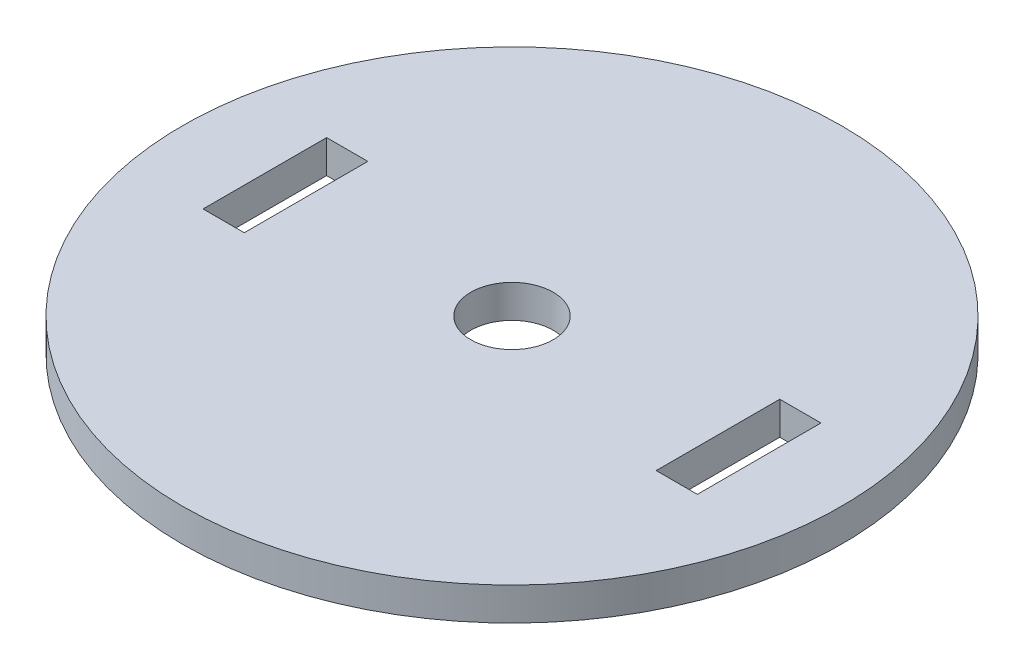
from build123d import *

# Parameters (mm, degrees)
SKETCH1_R           = 40
SKETCH1_R_2         = 5
BOSS_EXTRUDE1_DEPTH = 4
SKETCH2_W           = 5
SKETCH2_H           = 15
CUT_EXTRUDE1_DEPTH  = 4


with BuildPart() as part:
    # Sketch1 → Boss-Extrude1 (new body)
    with BuildSketch(Plane(origin=(0, 0, 0), x_dir=(1, 0, 0), z_dir=(0, 1, 0))):
        with Locations(Location((0, 0, 0), (0, 0, 270))):
            Circle(SKETCH1_R)
        with Locations(Location((0, 0, 0), (0, 0, 270))):
            Circle(SKETCH1_R_2, mode=Mode.SUBTRACT)
    extrude(amount=BOSS_EXTRUDE1_DEPTH)

    # Sketch2 → Cut-Extrude1 (cut)
    with BuildSketch(Plane(origin=(0, 4, 0), x_dir=(1, 0, 0), z_dir=(0, 1, 0))):
        with Locations((-27.5, 0)):
            Rectangle(SKETCH2_W, SKETCH2_H)
    cut_extrude1 = extrude(amount=-CUT_EXTRUDE1_DEPTH, mode=Mode.SUBTRACT)

    # Mirror1: Cut-Extrude1 across plane
    add(cut_extrude1.mirror(Plane(origin=(0, 0, 0), x_dir=(0, 0, 1), z_dir=(1, 0, 0))), mode=Mode.SUBTRACT)


solid = part.part
